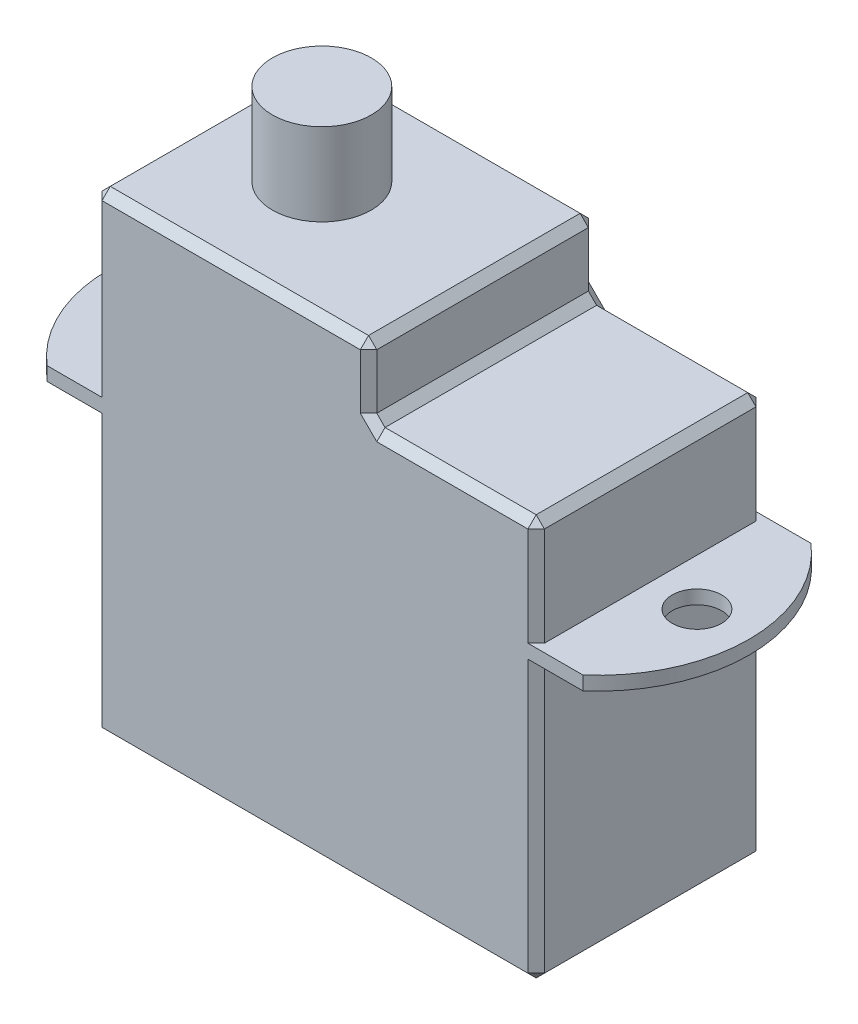
from build123d import *

# Parameters (mm, degrees)
EXTRUDE_1_DEPTH     = 8.3
SKETCH_9_R          = 1.8
EXTRUDE_6_DEPTH     = 3
CHAMFER_1_SIZE      = 0.3
EXTRUDE_7_DEPTH     = 0.5
SKETCH_11_R         = 0.9
CUT_EXTRUDE_1_DEPTH = 10


with BuildPart() as part:
    # 草图1 → 凸台-拉伸1 (new body)
    with BuildSketch(Plane.XY):
        Polygon((16.1, 10.2), (17.8, 10.2), (17.8, 10.7), (16.1, 10.7), (16.1, 14.6), (10, 14.6), (10, 17.2), (0, 17.2), (0, 10.7), (-1.7, 10.7), (-1.7, 10.2), (0, 10.2), (0, 0), (16.1, 0), align=None)
    extrude(amount=EXTRUDE_1_DEPTH)

    # 草图9 → 凸台-拉伸6 (add)
    with BuildSketch(Plane(origin=(0, 17.2, 0), x_dir=(1, 0, 0), z_dir=(0, 1, 0))):
        with Locations(Location((4, -4, 0), (0, 0, 270))):
            Circle(SKETCH_9_R)
    extrude(amount=EXTRUDE_6_DEPTH)

    # 倒角1
    chamfer_1_edges = [part.edges().sort_by_distance(p)[0] for p in [
        (8.05, 0, 0),
        (0, 5.1, 0),
        (0, 13.95, 0),
        (5, 17.2, 0),
        (10, 15.9, 0),
        (13.05, 14.6, 0),
        (16.1, 12.65, 0),
        (16.1, 5.1, 0),
        (16.1, 12.65, 8.3),
        (16.1, 0, 4.15),
        (0, 0, 4.15),
        (0, 17.2, 4.15),
        (10, 17.2, 4.15),
        (10, 14.6, 4.15),
        (16.1, 14.6, 4.15),
        (13.05, 14.6, 8.3),
        (10, 15.9, 8.3),
        (5, 17.2, 8.3),
        (0, 13.95, 8.3),
        (16.1, 5.1, 8.3),
        (0, 5.1, 8.3),
        (8.05, 0, 8.3),
    ]]
    chamfer(chamfer_1_edges, length=CHAMFER_1_SIZE)

    # 草图10 → 凸台-拉伸7 (add)
    with BuildSketch(Plane(origin=(0, 10.7, 0), x_dir=(1, 0, 0), z_dir=(0, 1, 0))):
        with BuildLine():
            Line((-1.7, -8.3), (-1.7, 0))
            ThreePointArc((-1.7, 0), (-3.6, -4.15), (-1.7, -8.3))
        make_face()
        with BuildLine():
            ThreePointArc((19.7, -4.15), (19.202419193, -1.867868321), (17.8, 0))
            Line((17.8, 0), (17.8, -8.3))
            ThreePointArc((17.8, -8.3), (19.202419193, -6.432131679), (19.7, -4.15))
        make_face()
    extrude(amount=-EXTRUDE_7_DEPTH)

    # 草图11 → 切除-拉伸1 (cut)
    with BuildSketch(Plane(origin=(0, 10.7, 0), x_dir=(1, 0, 0), z_dir=(0, 1, 0))):
        with Locations(Location((-1.7, -4.15, 0), (0, 0, 270))):
            Circle(SKETCH_11_R)
        with Locations(Location((17.8, -4.15, 0), (0, 0, 270))):
            Circle(SKETCH_11_R)
    extrude(amount=-CUT_EXTRUDE_1_DEPTH, mode=Mode.SUBTRACT)


solid = part.part
